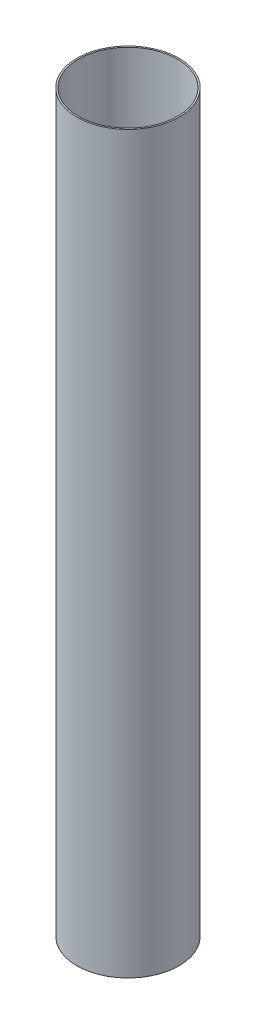
from build123d import *

# Parameters (mm, degrees)
SKETCH1_R           = 33.5
SKETCH1_R_2         = 32.5
BOSS_EXTRUDE1_DEPTH = 482


with BuildPart() as part:
    # Sketch1 → Boss-Extrude1 (new body)
    with BuildSketch(Plane(origin=(0, 0, 0), x_dir=(1, 0, 0), z_dir=(0, 1, 0))):
        with Locations(Location((0, 0, 0), (0, 0, 270))):
            Circle(SKETCH1_R)
        with Locations(Location((0, 0, 0), (0, 0, 270))):
            Circle(SKETCH1_R_2, mode=Mode.SUBTRACT)
    extrude(amount=BOSS_EXTRUDE1_DEPTH)


solid = part.part
